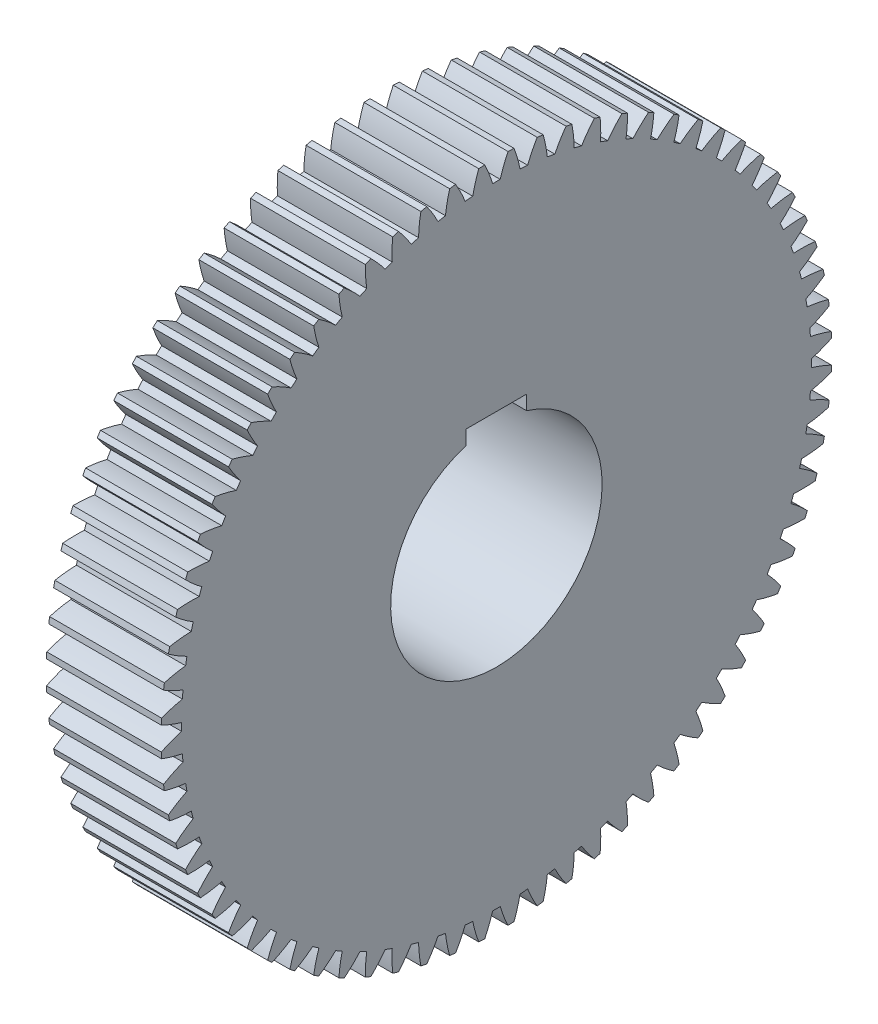
from build123d import *

# Parameters (mm, degrees)
BASPROSKE_W      = 38
BASPROSKE_H      = 111
TOOTHCUT_DEPTH   = 162.51160949
TEETHCUTS_COUNT  = 72
TEETHCUTS_ANGLE  = 355
HUBNEAONESKE_R   = 42.5
HUBNEARONE_DEPTH = 24.0000508
BORSKE_R         = 35
BORE_DEPTH       = 62.0000508
KEYSKE_W         = 20
KEYSKE_H         = 38.3
KEYWAY_DEPTH     = 62.0000508


with BuildPart() as part:
    # BasProSke → Base-Revolve (revolve)
    with BuildSketch(Plane(origin=(0, 0, 0), x_dir=(1, 0, 0), z_dir=(0, 1, 0)), mode=Mode.PRIVATE) as base_revolve_sk:
        with Locations((19, 55.5)):
            Rectangle(BASPROSKE_W, BASPROSKE_H)
    revolve(base_revolve_sk.sketch.rotate(Axis((-10, 0, 0), (1, 0, 0)), 180), axis=Axis((-10, 0, 0), (1, 0, 0)))

    # TooCutSke → ToothCut (cut, through all)
    with BuildSketch(Plane(origin=(0, 0, 0), x_dir=(0, 0, -1), z_dir=(1, 0, 0))):
        with BuildLine():
            ThreePointArc((1.260102081, 104.241384026), (0, 104.249), (-1.260102081, 104.241384026))
            ThreePointArc((-1.260102081, 104.241384026), (-2.419555529, 107.654106549), (-3.859459153, 110.958298564))
            ThreePointArc((-3.859459153, 110.958298564), (0, 111.0254), (3.859459153, 110.958298564))
            ThreePointArc((3.859459153, 110.958298564), (2.419555529, 107.654106549), (1.260102081, 104.241384026))
        make_face()
    toothcut = extrude(amount=TOOTHCUT_DEPTH, mode=Mode.SUBTRACT)

    # TeethCuts: ToothCut ×72 about axis
    teethcuts_axis = Axis((-10, 0, 0), (1, 0, 0))
    for i in range(1, TEETHCUTS_COUNT):
        add(toothcut.rotate(teethcuts_axis, i * TEETHCUTS_ANGLE / (TEETHCUTS_COUNT - 1)), mode=Mode.SUBTRACT)

    # HubNeaOneSke → HubNearOne (add)
    with BuildSketch(Plane.ZY):
        with Locations(Location((0, 0, 0), (0, 0, 180))):
            Circle(HUBNEAONESKE_R)
    extrude(amount=HUBNEARONE_DEPTH)

    # BorSke → Bore (cut, symmetric)
    with BuildSketch(Plane(origin=(0, 0, 0), x_dir=(0, 0, -1), z_dir=(1, 0, 0))):
        with Locations(Location((0, 0, 0), (0, 0, 180))):
            Circle(BORSKE_R)
    extrude(amount=BORE_DEPTH, both=True, mode=Mode.SUBTRACT)

    # KeySke → Keyway (cut, symmetric)
    with BuildSketch(Plane(origin=(0, 0, 0), x_dir=(0, 0, -1), z_dir=(1, 0, 0))):
        with Locations((0, 19.15)):
            Rectangle(KEYSKE_W, KEYSKE_H)
    extrude(amount=KEYWAY_DEPTH, both=True, mode=Mode.SUBTRACT)


solid = part.part
